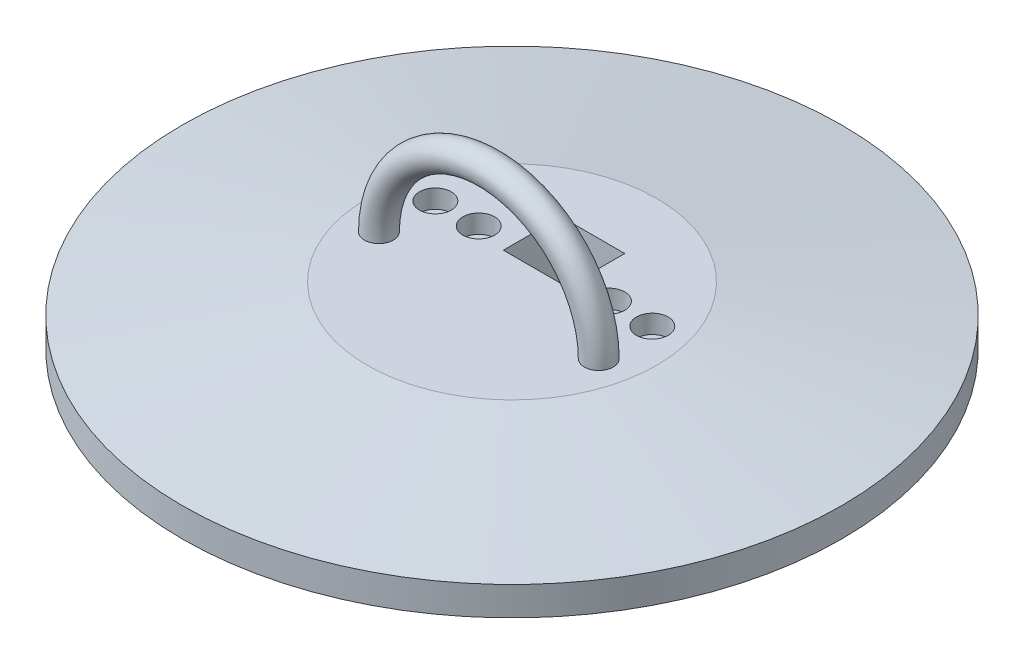
from build123d import *

# Parameters (mm, degrees)
SKETCH_5_R                   = 50
EXTRUDE_1_DEPTH              = 35
SKETCH_2_W                   = 22
SKETCH_2_H                   = 20
CUT_EXTRUDE_1_DEPTH          = 165.975755795
HOLE_WIZARD_M6_1_D           = 6.6
HOLE_WIZARD_M6_1_CBORE_D     = 11
HOLE_WIZARD_M6_1_CBORE_DEPTH = 6.4
CUT_EXTRUDE_START            = -15
CUT_EXTRUDE_5_DEPTH          = 15
SKETCH_7_R                   = 5


with BuildPart() as part:
    # 草圖1 → 旋轉1 (revolve)
    with BuildSketch(Plane(origin=(0, 0, 0), x_dir=(0, 0, -1), z_dir=(1, 0, 0))):
        Polygon((0, 0), (0, 20), (50, 20), (114, 10), (114, 0), align=None)
    revolve(axis=Axis((0, 0, 0), (0, 1, 0)))

    # 草圖5 → 填料-伸長1 (add)
    with BuildSketch(Plane(origin=(0, 20, 0), x_dir=(1, 0, 0), z_dir=(0, 1, 0))):
        with Locations(Location((0, 0, 0), (0, 0, 270))):
            Circle(SKETCH_5_R)
    extrude(amount=-EXTRUDE_1_DEPTH)

    # 草圖2 → 除料-伸長1 (cut, through all)
    with BuildSketch(Plane(origin=(0, 20, 0), x_dir=(1, 0, 0), z_dir=(0, 1, 0))):
        with Locations((0, 18)):
            Rectangle(SKETCH_2_W, SKETCH_2_H)
    extrude(amount=-CUT_EXTRUDE_1_DEPTH, mode=Mode.SUBTRACT)

    # M6 六角承窩頭蓋螺釘的柱孔1 (through all)
    with Locations(Plane(origin=(0, 20, 0), x_dir=(1, 0, 0), z_dir=(0, 1, 0))):
        with Locations((37.5, 11), (22.5, 11), (-22.5, 11), (-37.5, 11)):
            CounterBoreHole(HOLE_WIZARD_M6_1_D / 2, HOLE_WIZARD_M6_1_CBORE_D / 2, HOLE_WIZARD_M6_1_CBORE_DEPTH)

    # 草圖6 → 除料-伸長5 (cut)
    with BuildSketch(Plane.XZ.offset(15).offset(CUT_EXTRUDE_START)):
        with BuildLine():
            Line((-37.563279942, 33), (37.563279942, 33))
            ThreePointArc((37.563279942, 33), (0, 50), (-37.563279942, 33))
        make_face()
        with BuildLine():
            ThreePointArc((-37.563279942, -33), (0, -50), (37.563279942, -33))
            Line((37.563279942, -33), (-37.563279942, -33))
        make_face()
    extrude(amount=CUT_EXTRUDE_5_DEPTH, mode=Mode.SUBTRACT)

    # 掃出1: sweep along a path in 草圖8
    with BuildLine(Plane.XY.offset(8)) as sweep_1_path:
        ThreePointArc((37.792366216, 20), (0, 57.792366216), (-37.792366216, 20))
    # 草圖7 → 掃出1 (sweep)
    with BuildSketch(Plane(origin=(0, 20, 0), x_dir=(1, 0, 0), z_dir=(0, 1, 0))):
        with Locations((38, -8)):
            Circle(SKETCH_7_R)
    sweep(path=sweep_1_path.line)


solid = part.part
